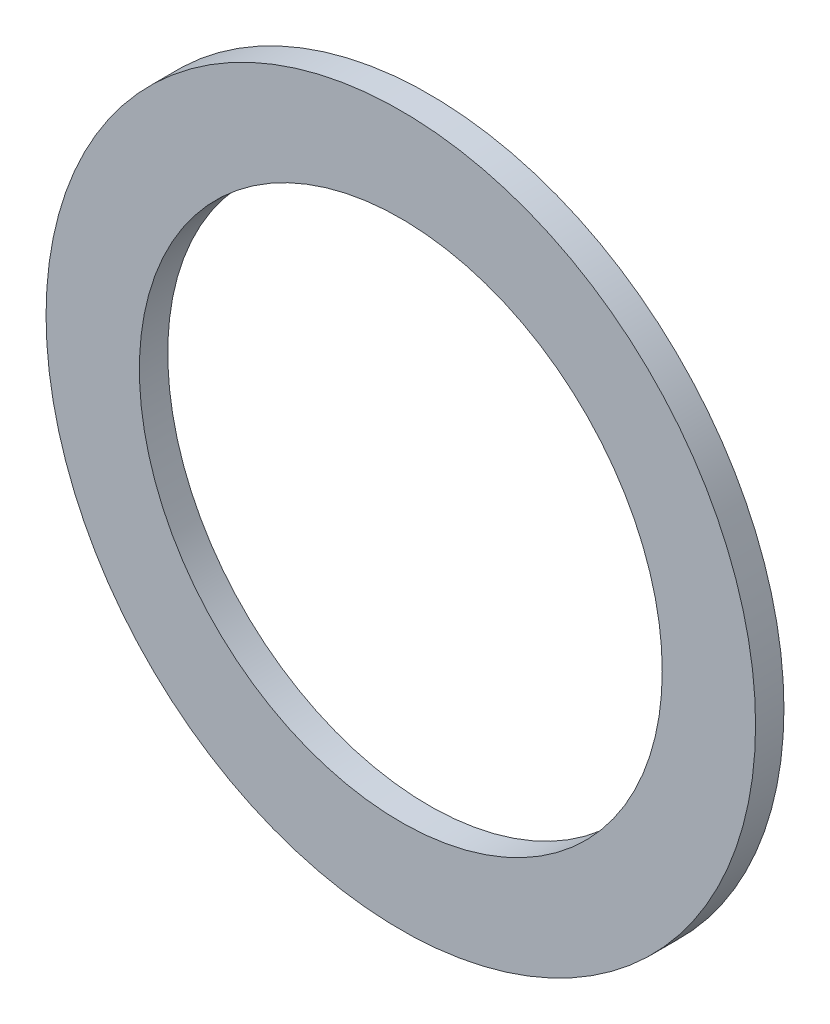
from build123d import *

# Parameters (mm, degrees)
ESQUISSE1_R                  = 20
ESQUISSE1_R_2                = 16.385
BASE_EXTRUSION_DEPTH         = 1.6
BOSS_EXTRU_5_DEPTH           = 1.6
R_P_TITION_CIRCULAIRE2_COUNT = 20


with BuildPart() as part:
    # Esquisse1 → Base-Extrusion (new body)
    with BuildSketch(Plane.XY):
        Circle(ESQUISSE1_R)
        Circle(ESQUISSE1_R_2, mode=Mode.SUBTRACT)
    extrude(amount=BASE_EXTRUSION_DEPTH)

    # Esquisse3 → Boss.-Extru.5 (add)
    with BuildSketch(Plane.XY.offset(1.6)):
        with BuildLine():
            Line((1.628948568, 15.499589628), (1.398577628, 14.834398125))
            Line((1.398577628, 14.834398125), (1.195374634, 14.690915144))
            ThreePointArc((1.195374634, 14.690915144), (-2.305760746, 14.558000401), (-5.676611278, 13.602499501))
            Line((-5.676611278, 13.602499501), (-5.914207488, 13.676166747))
            Line((-5.914207488, 13.676166747), (-6.338858752, 14.237612925))
            ThreePointArc((-6.338858752, 14.237612925), (-6.917683544, 14.610159172), (-7.600152086, 14.520350848))
            ThreePointArc((-7.600152086, 14.520350848), (-2.563821531, 16.187332073), (2.74113899, 16.158250448))
            ThreePointArc((2.74113899, 16.158250448), (2.064320537, 16.032768861), (1.628948568, 15.499589628))
        make_face()
    boss_extru_5 = extrude(amount=-BOSS_EXTRU_5_DEPTH)

    # Répétition circulaire2: Boss.-Extru.5 ×20 about axis
    r_p_tition_circulaire2_axis = Axis((0, 0, 0), (0, 0, -1))
    for i in range(1, R_P_TITION_CIRCULAIRE2_COUNT):
        add(boss_extru_5.rotate(r_p_tition_circulaire2_axis, i * 360 / R_P_TITION_CIRCULAIRE2_COUNT))


solid = part.part
